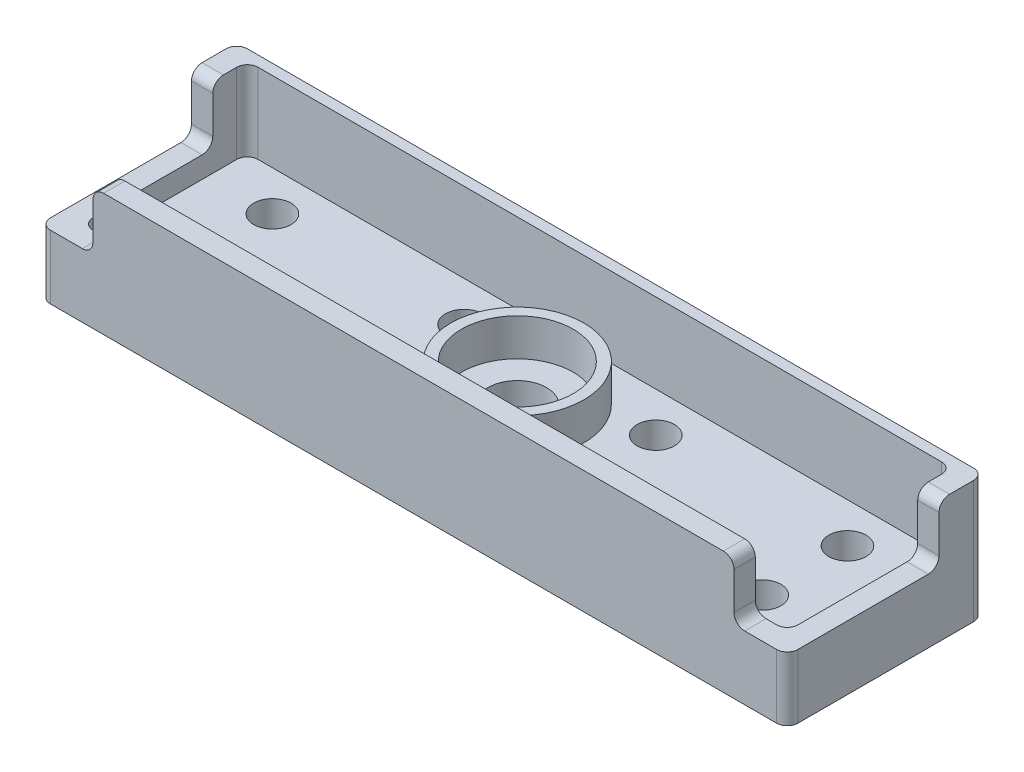
from build123d import *

# Parameters (mm, degrees)
SKETCH1_W           = 35.1
SKETCH1_H           = 18.5
BOSS_EXTRUDE1_DEPTH = 11.5
SKETCH7_W           = 33.1
SKETCH7_H           = 15.5
CUT_EXTRUDE5_DEPTH  = 7.5
SKETCH2_R           = 1.75
CUT_EXTRUDE1_DEPTH  = 39.076534769
SKETCH4_W           = 14.25
SKETCH4_H           = 5.5
CUT_EXTRUDE3_DEPTH  = 5
SKETCH5_R           = 2.75
CUT_EXTRUDE4_DEPTH  = 39.076534769
SKETCH6_R           = 6.25
SKETCH6_R_2         = 5.25
BOSS_EXTRUDE2_DEPTH = 3.5
FILLET3_R           = 1
FILLET6_R           = 1


with BuildPart() as part:
    # Sketch1 → Boss-Extrude1 (new body)
    with BuildSketch(Plane(origin=(0, 0, 0), x_dir=(1, 0, 0), z_dir=(0, 1, 0))):
        with Locations((-17.55, 0)):
            Rectangle(SKETCH1_W, SKETCH1_H)
    extrude(amount=BOSS_EXTRUDE1_DEPTH)

    # Sketch7 → Cut-Extrude5 (cut)
    with BuildSketch(Plane(origin=(0, 11.5, 0), x_dir=(1, 0, 0), z_dir=(0, 1, 0))):
        with Locations((-16.55, 0.5)):
            Rectangle(SKETCH7_W, SKETCH7_H)
    extrude(amount=-CUT_EXTRUDE5_DEPTH, mode=Mode.SUBTRACT)

    # Sketch2 → Cut-Extrude1 (cut, through all)
    with BuildSketch(Plane(origin=(0, 0, 0), x_dir=(-1, 0, 0), z_dir=(0, 1, 0))):
        with Locations(Location((27, 3.5, 0), (0, 0, 270))):
            Circle(SKETCH2_R)
        with Locations(Location((9, 3.5, 0), (0, 0, 270))):
            Circle(SKETCH2_R)
        with Locations(Location((27, -4.5, 0), (0, 0, 270))):
            Circle(SKETCH2_R)
        with Locations(Location((9, -4.5, 0), (0, 0, 270))):
            Circle(SKETCH2_R)
    extrude(amount=CUT_EXTRUDE1_DEPTH, mode=Mode.SUBTRACT)

    # Sketch4 → Cut-Extrude3 (cut)
    with BuildSketch(Plane.ZY.offset(35.1)):
        with Locations((2.125, 8.75)):
            Rectangle(SKETCH4_W, SKETCH4_H)
    extrude(amount=-CUT_EXTRUDE3_DEPTH, mode=Mode.SUBTRACT)

    # Mirror1: part across plane


with BuildPart() as part_1:
    add(part.part)
    add(part.part.mirror(Plane(origin=(0, 0, 0), x_dir=(0, 0, 1), z_dir=(1, 0, 0))))

    # Sketch5 → Cut-Extrude4 (cut, through all)
    with BuildSketch(Plane(origin=(0, 0, 0), x_dir=(1, 0, 0), z_dir=(0, 1, 0))):
        with Locations(Location((0, 0.5, 0), (0, 0, 90))):
            Circle(SKETCH5_R)
    extrude(amount=CUT_EXTRUDE4_DEPTH, mode=Mode.SUBTRACT)

    # Sketch6 → Boss-Extrude2 (add)
    with BuildSketch(Plane(origin=(0, 4, 0), x_dir=(1, 0, 0), z_dir=(0, 1, 0))):
        with Locations(Location((0, 0.5, 0), (0, 0, 90))):
            Circle(SKETCH6_R)
        with Locations(Location((0, 0.5, 0), (0, 0, 270))):
            Circle(SKETCH6_R_2, mode=Mode.SUBTRACT)
    extrude(amount=BOSS_EXTRUDE2_DEPTH)

    # Fillet3
    fillet3_edges = [part_1.edges().sort_by_distance(p)[0] for p in [
        (-34.1, 6, -5),
        (-34.1, 11.5, -5),
        (-30.1, 11.5, 8.25),
        (-30.1, 6, 8.25),
        (34.1, 11.5, -5),
        (34.1, 6, -5),
        (30.1, 11.5, 8.25),
        (30.1, 6, 8.25),
    ]]
    fillet(fillet3_edges, radius=FILLET3_R)

    # Fillet6
    fillet6_edges = [part_1.edges().sort_by_distance(p)[0] for p in [
        (-33.1, 7.75, -8.25),
        (-33.1, 5, 7.25),
        (-35.1, 3, 9.25),
        (35.1, 5.75, -9.25),
        (35.1, 3, 9.25),
        (33.1, 7.75, -8.25),
        (33.1, 5, 7.25),
        (-35.1, 5.75, -9.25),
    ]]
    fillet(fillet6_edges, radius=FILLET6_R)


solid = part_1.part
